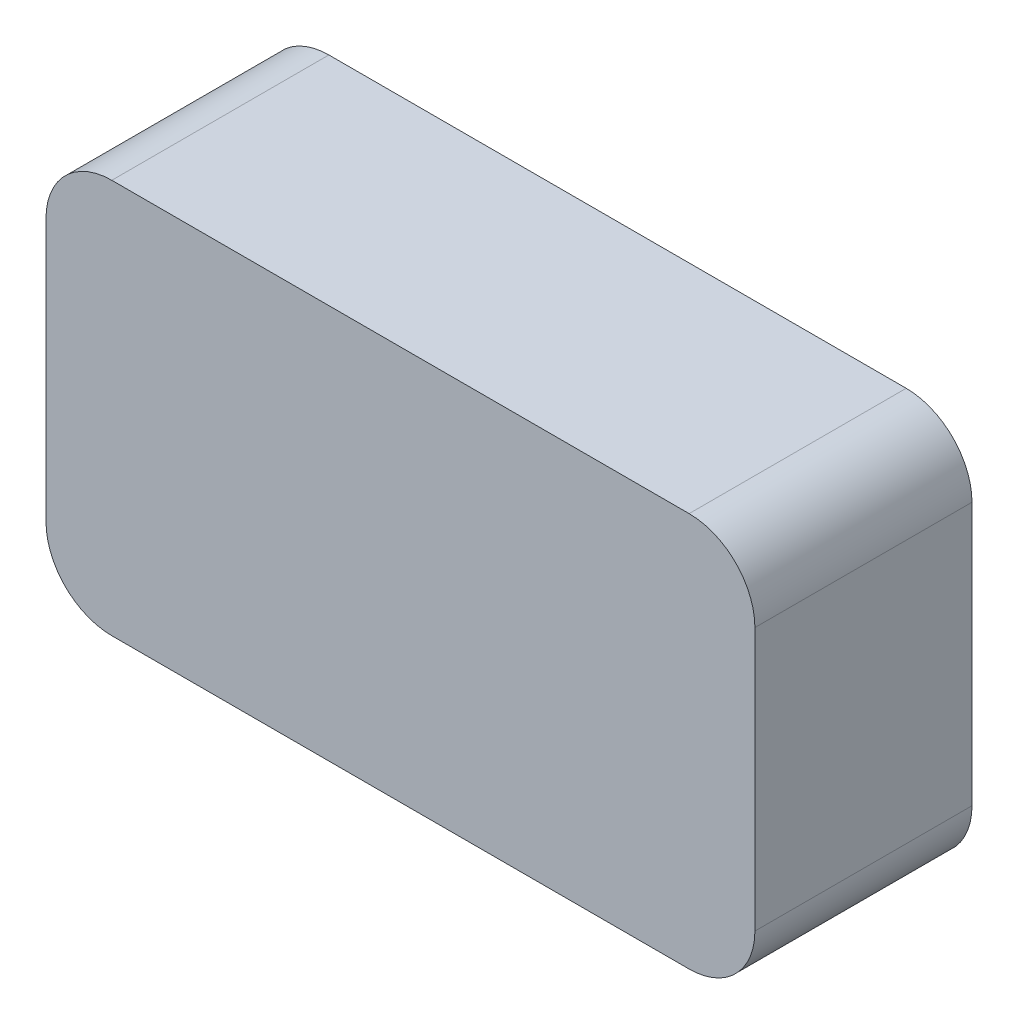
from build123d import *

# Parameters (mm, degrees)
SKETCH_1_W      = 107.764696886
SKETCH_1_H      = 59.957319102
EXTRUDE_1_DEPTH = 33
FILLET_1_R      = 10
FILLET_2_R      = 10
FILLET_4_R      = 10
FILLET_5_R      = 10
SKETCH_2_R      = 2.546868178
EXTRUDE_2_DEPTH = 3


with BuildPart() as part:
    # 草图1 → 凸台-拉伸1 (new body)
    with BuildSketch(Plane.XY):
        Rectangle(SKETCH_1_W, SKETCH_1_H)
    extrude(amount=EXTRUDE_1_DEPTH)

    # 圆角1
    fillet_1_edges = [part.edges().sort_by_distance(p)[0] for p in [
        (53.882348443, 29.978659551, 16.5),
    ]]
    fillet(fillet_1_edges, radius=FILLET_1_R)

    # 圆角2
    fillet_2_edges = [part.edges().sort_by_distance(p)[0] for p in [
        (53.882348443, -29.978659551, 16.5),
    ]]
    fillet(fillet_2_edges, radius=FILLET_2_R)

    # 圆角4
    fillet_4_edges = [part.edges().sort_by_distance(p)[0] for p in [
        (-53.882348443, 29.978659551, 16.5),
    ]]
    fillet(fillet_4_edges, radius=FILLET_4_R)

    # 圆角5
    fillet_5_edges = [part.edges().sort_by_distance(p)[0] for p in [
        (-53.882348443, -29.978659551, 16.5),
    ]]
    fillet(fillet_5_edges, radius=FILLET_5_R)

    # 草图2 → 凸台-拉伸2 (add)
    with BuildSketch(Plane(origin=(0, 0, 0), x_dir=(-1, 0, 0), z_dir=(0, 0, -1))):
        with Locations(Location((-36.108931064, 0, 0), (0, 0, 180))):
            Circle(SKETCH_2_R)
    extrude(amount=EXTRUDE_2_DEPTH)


solid = part.part
